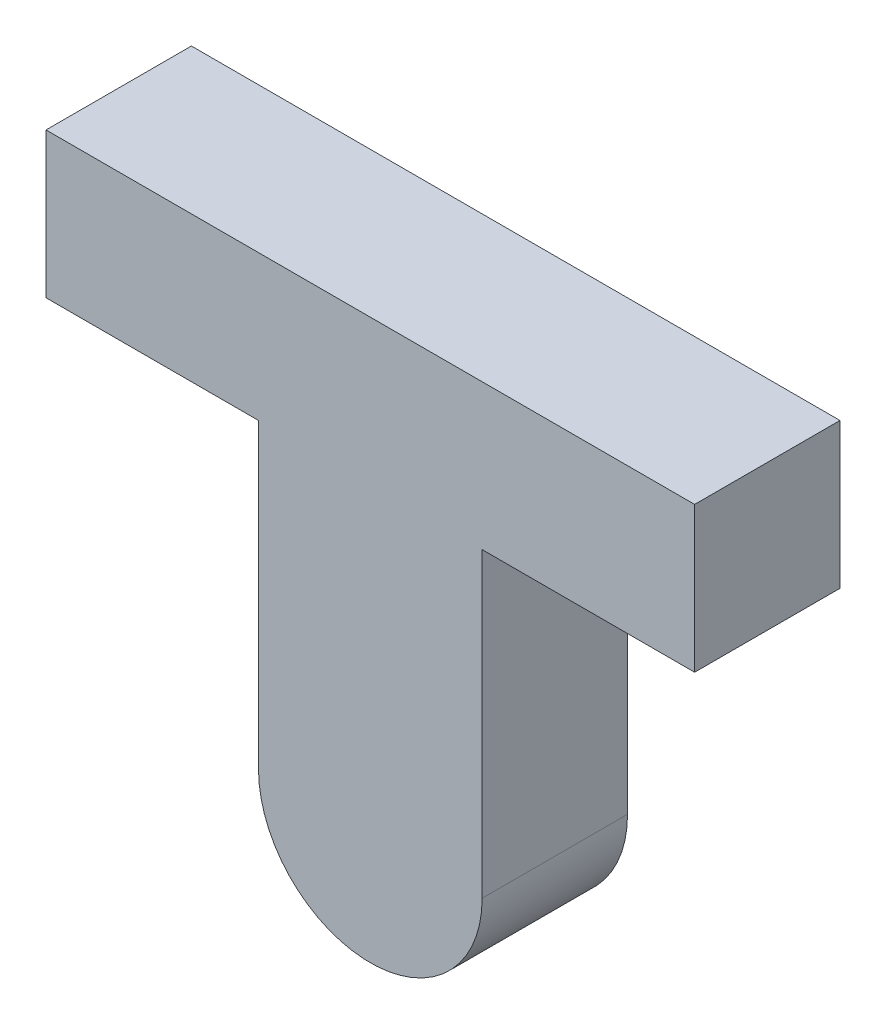
from build123d import *

# Parameters (mm, degrees)
BOSS_EXTRUDE1_DEPTH = 0.65


with BuildPart() as part:
    # Sketch1 → Boss-Extrude1 (new, symmetric)
    with BuildSketch(Plane.XY):
        with BuildLine():
            Line((1, 2.7), (2.9, 2.7))
            Line((2.9, 2.7), (2.9, 4))
            Line((2.9, 4), (-2.9, 4))
            Line((-2.9, 4), (-2.9, 2.7))
            Line((-2.9, 2.7), (-1, 2.7))
            Line((-1, 2.7), (-1, 0))
            ThreePointArc((-1, 0), (0, -1), (1, 0))
            Line((1, 0), (1, 2.7))
        make_face()
    extrude(amount=BOSS_EXTRUDE1_DEPTH, both=True)


solid = part.part
